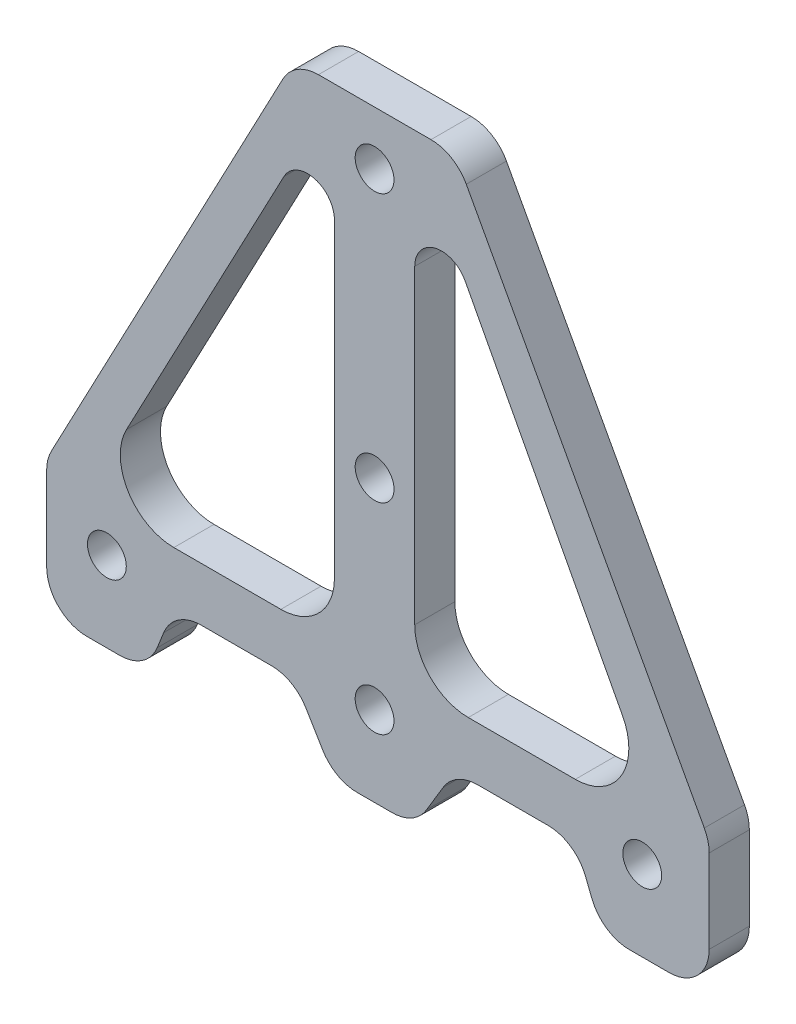
from build123d import *

# Parameters (mm, degrees)
SKETCH_1_R          = 1.45
EXTRUDE_1_DEPTH     = 3
CUT_EXTRUDE_1_DEPTH = 3
FILLET_1_R          = 3
FILLET_2_R          = 4


with BuildPart() as part:
    # 草图1 → 凸台-拉伸1 (new body)
    with BuildSketch(Plane.XY):
        Polygon((-24.5, -6), (25, -6), (25, 4), (6, 39), (-6, 39), (-24.5, 4), align=None)
        with Locations((-20, 0)):
            Circle(SKETCH_1_R, mode=Mode.SUBTRACT)
        with Locations((20, 0)):
            Circle(SKETCH_1_R, mode=Mode.SUBTRACT)
        with Locations((0, 35)):
            Circle(SKETCH_1_R, mode=Mode.SUBTRACT)
        with Locations((0, 15)):
            Circle(SKETCH_1_R, mode=Mode.SUBTRACT)
        Circle(SKETCH_1_R, mode=Mode.SUBTRACT)
        with BuildLine():
            Line((-3, 30.192295018), (-3, 3))
            Line((-3, 3), (-21.635270706, 3))
            Line((-21.635270706, 3), (-6.768189881, 31.126909669))
            ThreePointArc((-6.768189881, 31.126909669), (-4.518533366, 32.133477616), (-3, 30.192295018))
        make_face(mode=Mode.SUBTRACT)
        with BuildLine():
            Line((21.635270706, 3), (6.768189881, 31.126909669))
            ThreePointArc((6.768189881, 31.126909669), (4.518533366, 32.133477616), (3, 30.192295018))
            Line((3, 30.192295018), (3, 3))
            Line((3, 3), (21.635270706, 3))
        make_face(mode=Mode.SUBTRACT)
    extrude(amount=EXTRUDE_1_DEPTH)

    # 草图3 → 切除-拉伸1 (cut)
    with BuildSketch(Plane.XY.offset(3)):
        Polygon((-17, -6), (-15, -1), (-6, -1), (-3, -6), align=None)
        Polygon((3, -6), (17, -6), (15, -1), (6, -1), align=None)
    extrude(amount=-CUT_EXTRUDE_1_DEPTH, mode=Mode.SUBTRACT)

    # 圆角1
    fillet_1_edges = [part.edges().sort_by_distance(p)[0] for p in [
        (-24.5, 4, 1.5),
        (-6, 39, 1.5),
        (6, 39, 1.5),
        (25, 4, 1.5),
        (25, -6, 1.5),
        (-24.5, -6, 1.5),
        (-3, -6, 1.5),
        (-17, -6, 1.5),
        (-15, -1, 1.5),
        (-6, -1, 1.5),
        (3, -6, 1.5),
        (6, -1, 1.5),
        (15, -1, 1.5),
        (17, -6, 1.5),
    ]]
    fillet(fillet_1_edges, radius=FILLET_1_R)

    # 圆角2
    fillet_2_edges = [part.edges().sort_by_distance(p)[0] for p in [
        (-21.635270706, 3, 1.5),
        (-3, 3, 1.5),
        (3, 3, 1.5),
        (21.635270706, 3, 1.5),
    ]]
    fillet(fillet_2_edges, radius=FILLET_2_R)


solid = part.part
